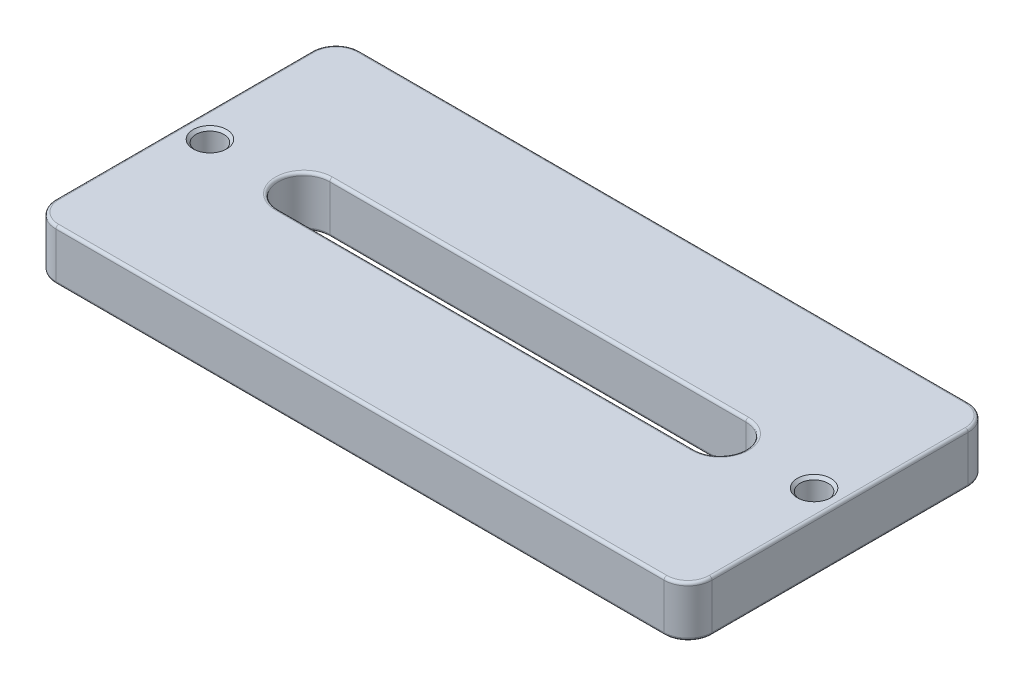
from build123d import *

# Parameters (mm, degrees)
SKETCH1_W           = 82
SKETCH1_H           = 38
SKETCH1_R           = 1.75
BOSS_EXTRUDE1_DEPTH = 6.35
FILLET2_R           = 3
FILLET3_R           = 0.35
CHAMFER1_SIZE       = 0.35


with BuildPart() as part:
    # Sketch1 → Boss-Extrude1 (new body)
    with BuildSketch(Plane(origin=(0, 0, 0), x_dir=(1, 0, 0), z_dir=(0, 1, 0))):
        Rectangle(SKETCH1_W, SKETCH1_H)
        with Locations(Location((37.75, 0, 0), (0, 0, 270))):
            Circle(SKETCH1_R, mode=Mode.SUBTRACT)
        with Locations(Location((-37.75, 0, 0), (0, 0, 270))):
            Circle(SKETCH1_R, mode=Mode.SUBTRACT)
        with BuildLine():
            Line((-25.9975, 3.225), (-13.623486154, 3.225))
            Line((-13.623486154, 3.225), (13.623486154, 3.225))
            Line((13.623486154, 3.225), (25.9975, 3.225))
            ThreePointArc((25.9975, 3.225), (29.2225, 0), (25.9975, -3.225))
            Line((25.9975, -3.225), (13.623486154, -3.225))
            Line((13.623486154, -3.225), (-13.623486154, -3.225))
            Line((-13.623486154, -3.225), (-25.9975, -3.225))
            ThreePointArc((-25.9975, -3.225), (-29.2225, 0), (-25.9975, 3.225))
        make_face(mode=Mode.SUBTRACT)
    extrude(amount=BOSS_EXTRUDE1_DEPTH)

    # Fillet2
    fillet2_edges = [part.edges().sort_by_distance(p)[0] for p in [
        (-41, 3.175, -19),
        (41, 3.175, -19),
        (41, 3.175, 19),
        (-41, 3.175, 19),
    ]]
    fillet(fillet2_edges, radius=FILLET2_R)

    # Fillet3
    fillet3_edges = [part.edges().sort_by_distance(p)[0] for p in [
        (-29.2225, 0, 0),
        (0, 0, 3.225),
        (29.2225, 0, 0),
        (0, 0, -3.225),
        (0, 6.35, -3.225),
        (-29.2225, 6.35, 0),
        (0, 6.35, 3.225),
        (29.2225, 6.35, 0),
        (0, 0, -19),
        (0, 6.35, -19),
        (-41, 0, 0),
        (41, 0, 0),
        (0, 0, 19),
        (-40.121320344, 0, 18.121320344),
        (-40.121320344, 0, -18.121320344),
        (40.121320344, 0, 18.121320344),
        (40.121320344, 0, -18.121320344),
        (41, 6.35, 0),
        (-41, 6.35, 0),
        (0, 6.35, 19),
        (-40.121320344, 6.35, 18.121320344),
        (-40.121320344, 6.35, -18.121320344),
        (40.121320344, 6.35, 18.121320344),
        (40.121320344, 6.35, -18.121320344),
    ]]
    fillet(fillet3_edges, radius=FILLET3_R)

    # Chamfer1
    chamfer1_edges = [part.edges().sort_by_distance(p)[0] for p in [
        (37.75, 0, -1.75),
        (37.75, 6.35, -1.75),
        (-37.75, 0, -1.75),
        (-37.75, 6.35, -1.75),
    ]]
    chamfer(chamfer1_edges, length=CHAMFER1_SIZE)


solid = part.part
